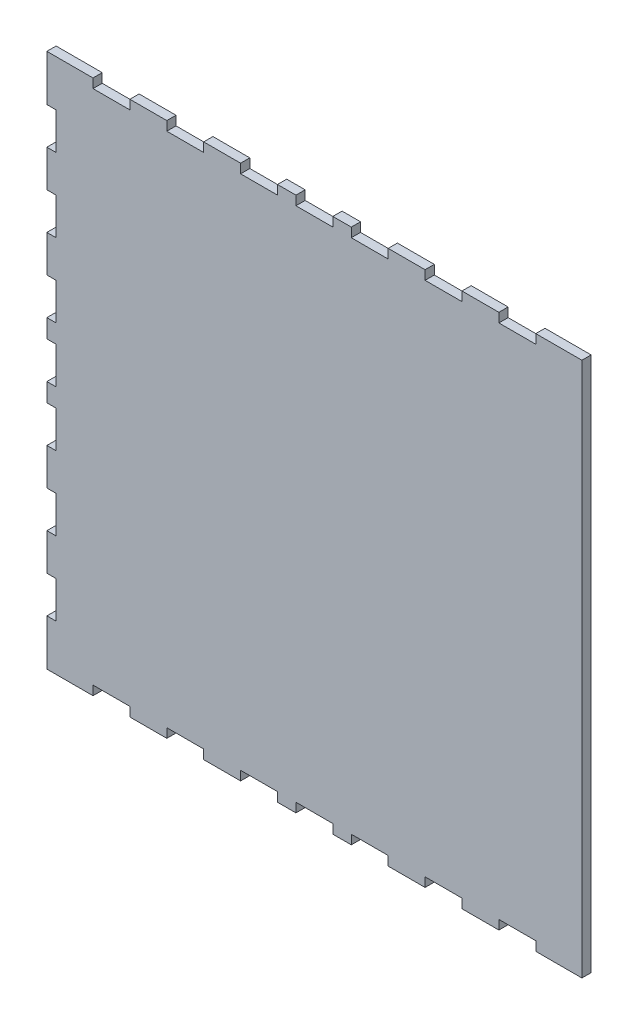
from build123d import *

# Parameters (mm, degrees)
EXTRUDE1_DEPTH = 6.35


with BuildPart() as part:
    # Sketch1 → Extrude1 (new body)
    with BuildSketch(Plane.XY):
        Polygon((500.815587146, 387.589172699), (500.815587146, 19.289172699), (469.065587146, 19.289172699), (469.065587146, 25.639172699), (443.665587146, 25.639172699), (443.665587146, 19.289172699), (418.265587146, 19.289172699), (418.265587146, 25.639172699), (392.865587146, 25.639172699), (392.865587146, 19.289172699), (367.465587146, 19.289172699), (367.465587146, 25.639172699), (342.065587146, 25.639172699), (342.065587146, 19.289172699), (329.365587146, 19.289172699), (329.365587146, 25.639172699), (303.965587146, 25.639172699), (303.965587146, 19.289172699), (291.265587146, 19.289172699), (291.265587146, 25.639172699), (265.865587146, 25.639172699), (265.865587146, 19.289172699), (240.465587146, 19.289172699), (240.465587146, 25.639172699), (215.065587146, 25.639172699), (215.065587146, 19.289172699), (189.665587146, 19.289172699), (189.665587146, 25.639172699), (164.265587146, 25.639172699), (164.265587146, 19.289172699), (132.515587146, 19.289172699), (132.515587146, 51.039172699), (138.865587146, 51.039172699), (138.865587146, 76.439172699), (132.515587146, 76.439172699), (132.515587146, 101.839172699), (138.865587146, 101.839172699), (138.865587146, 127.239172699), (132.515587146, 127.239172699), (132.515587146, 152.639172699), (138.865587146, 152.639172699), (138.865587146, 178.039172699), (132.515587146, 178.039172699), (132.515587146, 190.739172699), (138.865587146, 190.739172699), (138.865587146, 216.139172699), (132.515587146, 216.139172699), (132.515587146, 228.839172699), (138.865587146, 228.839172699), (138.865587146, 254.239172699), (132.515587146, 254.239172699), (132.515587146, 279.639172699), (138.865587146, 279.639172699), (138.865587146, 305.039172699), (132.515587146, 305.039172699), (132.515587146, 330.439172699), (138.865587146, 330.439172699), (138.865587146, 355.839172699), (132.515587146, 355.839172699), (132.515587146, 387.589172699), (164.265587146, 387.589172699), (164.265587146, 381.239172699), (189.665587146, 381.239172699), (189.665587146, 387.589172699), (215.065587146, 387.589172699), (215.065587146, 381.239172699), (240.465587146, 381.239172699), (240.465587146, 387.589172699), (265.865587146, 387.589172699), (265.865587146, 381.239172699), (291.265587146, 381.239172699), (291.265587146, 387.589172699), (303.965587146, 387.589172699), (303.965587146, 381.239172699), (329.365587146, 381.239172699), (329.365587146, 387.589172699), (342.065587146, 387.589172699), (342.065587146, 381.239172699), (367.465587146, 381.239172699), (367.465587146, 387.589172699), (392.865587146, 387.589172699), (392.865587146, 381.239172699), (418.265587146, 381.239172699), (418.265587146, 387.589172699), (443.665587146, 387.589172699), (443.665587146, 381.239172699), (469.065587146, 381.239172699), (469.065587146, 387.589172699), align=None)
    extrude(amount=EXTRUDE1_DEPTH)


solid = part.part
